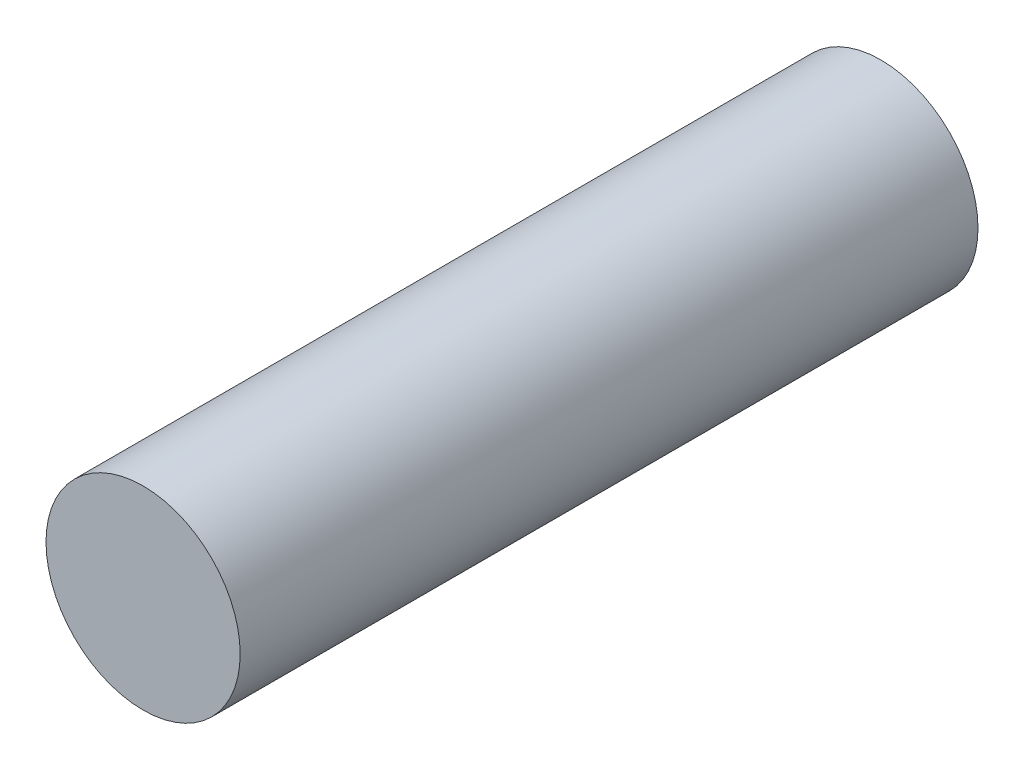
from build123d import *

# Parameters (mm, degrees)
SKETCH1_R           = 1.075
BOSS_EXTRUDE1_DEPTH = 8.17


with BuildPart() as part:
    # Sketch1 → Boss-Extrude1 (new body)
    with BuildSketch(Plane.XY):
        Circle(SKETCH1_R)
    extrude(amount=BOSS_EXTRUDE1_DEPTH)


solid = part.part
